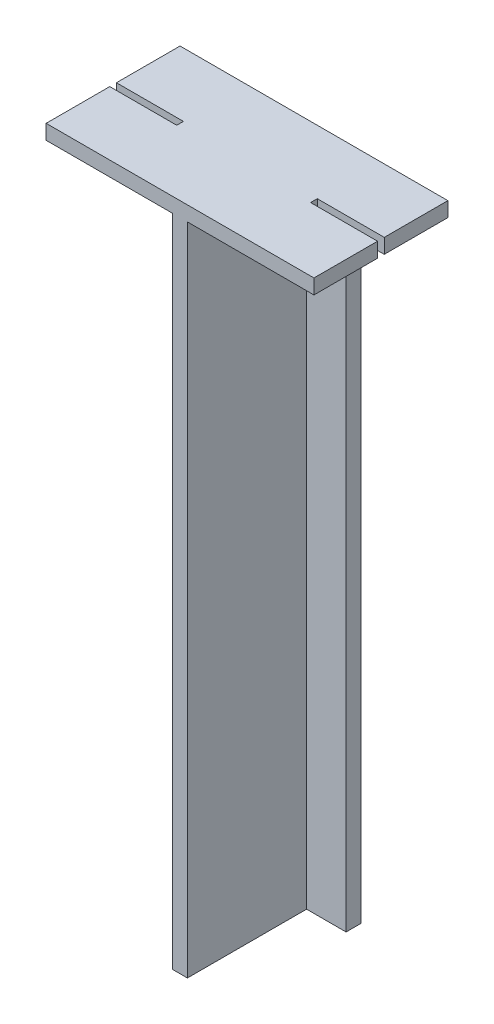
from build123d import *

# Parameters (mm, degrees)
BOSS_EXTRU_1_DEPTH = 22
ESQUISSE3_W        = 22
ESQUISSE3_H        = 178
BOSS_EXTRU_2_DEPTH = 1000


with BuildPart() as part:
    # Esquisse2 → Boss.-Extru.1 (new body)
    with BuildSketch(Plane(origin=(0, 0, 0), x_dir=(1, 0, 0), z_dir=(0, 1, 0))):
        Polygon((-200, 0), (0, 0), (0, 200), (-200, 200), (-200, 105), (-100, 105), (-100, 95), (-200, 95), align=None)
    boss_extru_1 = extrude(amount=BOSS_EXTRU_1_DEPTH)

    # Symétrie1: Boss.-Extru.1 across plane
    add(boss_extru_1.mirror(Plane(origin=(0, 22, 0), x_dir=(0, 0, 1), z_dir=(-1, 0, 0))))

    # Esquisse3 → Boss.-Extru.2 (add)
    with BuildSketch(Plane(origin=(0, 22, 0), x_dir=(1, 0, 0), z_dir=(0, 1, 0))):
        Polygon((70, 200), (-70, 200), (-70, 178), (-11, 178), (11, 178), (70, 178), align=None)
        with Locations((0, 89)):
            Rectangle(ESQUISSE3_W, ESQUISSE3_H)
    extrude(amount=-BOSS_EXTRU_2_DEPTH)


solid = part.part
